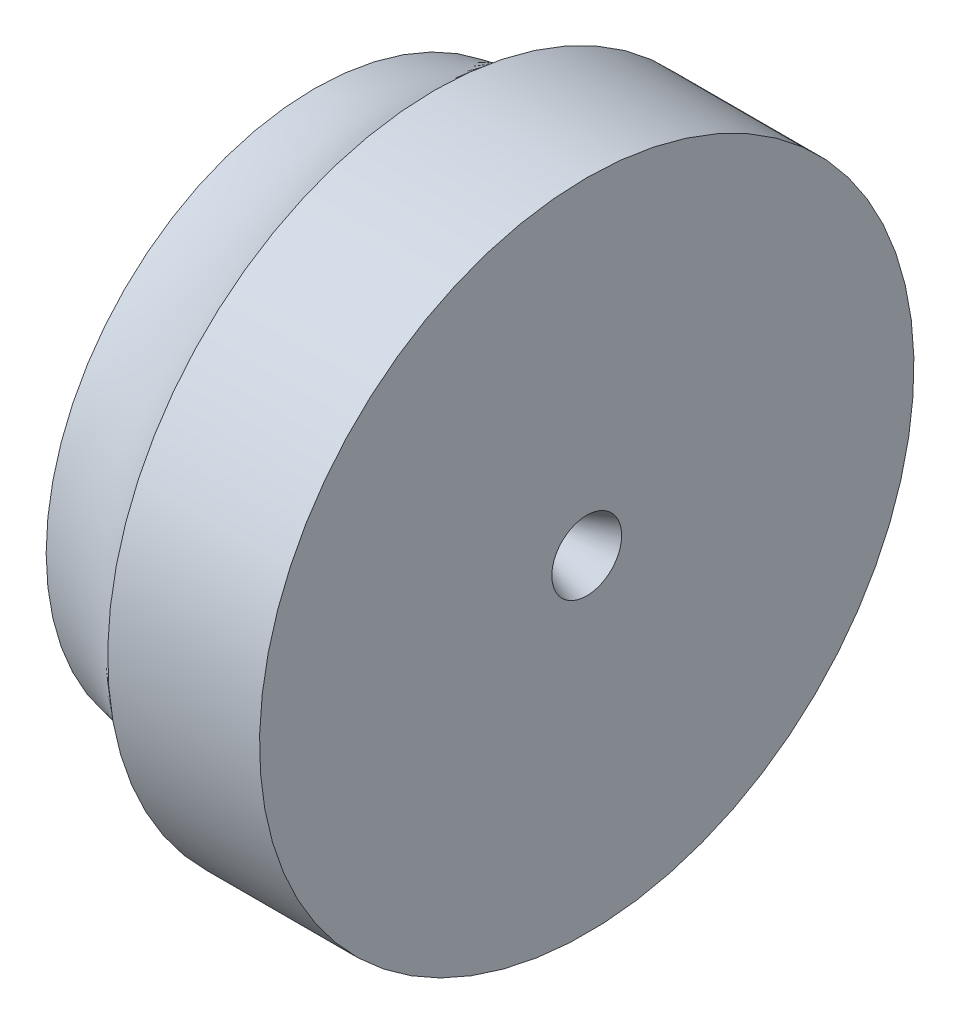
from build123d import *


with BuildPart() as part:
    # Sketch2 → Revolve1 (revolve)
    with BuildSketch(Plane.XY):
        with BuildLine():
            Line((0, 0), (0, 14.55))
            Line((0, 14.55), (-16.200000205, 30.750000205))
            ThreePointArc((-16.200000205, 30.750000205), (-8.768669823, 33.038724621), (-2.400000205, 37.5))
            Line((-2.400000205, 37.5), (15, 37.5))
            Line((15, 37.5), (15, 4))
            Line((15, 4), (5, 0))
            Line((5, 0), (0, 0))
        make_face()
    revolve(axis=Axis((5, 0, 0), (-1, 0, 0)))


solid = part.part
